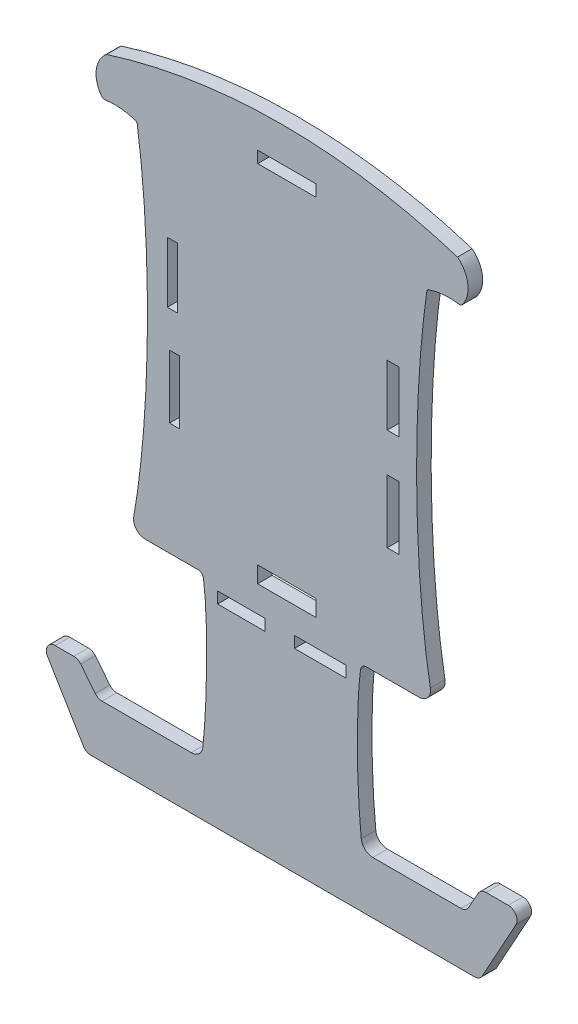
from build123d import *

# Parameters (mm, degrees)
SKETCH1_W           = 20
SKETCH1_H           = 4
SKETCH1_W_2         = 17.635389858
SKETCH1_H_2         = 3.879785769
SKETCH1_W_3         = 4.102446126
SKETCH1_H_3         = 20.774322756
SKETCH1_H_4         = 21.660832558
SKETCH1_W_4         = 3.418162198
SKETCH1_H_5         = 5.631856247
SKETCH1_W_5         = 16.224558669
BOSS_EXTRUDE3_DEPTH = 5


with BuildPart() as part:
    # Sketch1 → Boss-Extrude3 (new body)
    with BuildSketch(Plane.XY):
        with BuildLine():
            Line((-46.908869484, -52.720617246), (-28.908869484, -52.720617246))
            ThreePointArc((-28.908869484, -52.720617246), (-27.586230621, -53.216332062), (-26.915218553, -54.459251828))
            add(Edge.make_bspline(
                [(-27.150183285, -104.622936523), (-24.042180825, -75.385235173), (-26.915218553, -54.459251828)],
                knots=[4.03312472, 4.03312472, 4.03312472, 5.695988701, 5.695988701, 5.695988701], degree=2, weights=[1, 0.673818357, 1]))
            ThreePointArc((-27.150183285, -104.622936523), (-28.453010553, -107.174276905), (-31.127773146, -108.200113985))
            Line((-31.127773146, -108.200113985), (-61.691034949, -108.200113985))
            ThreePointArc((-61.691034949, -108.200113985), (-62.986836684, -107.905829762), (-64.028415748, -107.080712561))
            Line((-64.028415748, -107.080712561), (-69.031690033, -100.862183312))
            ThreePointArc((-69.031690033, -100.862183312), (-70.073269096, -100.037066111), (-71.369070832, -99.742781887))
            Line((-71.369070832, -99.742781887), (-77.798044438, -99.742781887))
            ThreePointArc((-77.798044438, -99.742781887), (-80.408451089, -101.264344498), (-80.370926301, -104.285597145))
            Line((-80.370926301, -104.285597145), (-68.103793269, -124.742929243))
            ThreePointArc((-68.103793269, -124.742929243), (-67.009348795, -125.810520637), (-65.530911406, -126.200113985))
            Line((-65.530911406, -126.200113985), (65.997283419, -126.200113985))
            ThreePointArc((65.997283419, -126.200113985), (67.523464533, -125.782897602), (68.625147136, -124.647294791))
            Line((68.625147136, -124.647294791), (80.198497538, -103.631822855))
            ThreePointArc((80.198497538, -103.631822855), (80.153417437, -100.658460936), (77.570633821, -99.18464205))
            Line((77.570633821, -99.18464205), (69.904360471, -99.18464205))
            ThreePointArc((69.904360471, -99.18464205), (68.383344987, -99.598812996), (67.282303117, -100.726967452))
            Line((67.282303117, -100.726967452), (63.985194726, -106.657788583))
            ThreePointArc((63.985194726, -106.657788583), (62.884152857, -107.785943039), (61.363137372, -108.200113985))
            Line((61.363137372, -108.200113985), (31.127773146, -108.200113985))
            ThreePointArc((31.127773146, -108.200113985), (28.453010553, -107.174276905), (27.150183285, -104.622936523))
            add(Edge.make_bspline(
                [(26.915218553, -54.459251828), (24.042180825, -75.385235173), (27.150183285, -104.622936523)],
                knots=[0.587196606, 0.587196606, 0.587196606, 2.250060588, 2.250060588, 2.250060588], degree=2, weights=[1, 0.673818357, 1]))
            ThreePointArc((26.915218553, -54.459251828), (27.586230621, -53.216332062), (28.908869484, -52.720617246))
            Line((28.908869484, -52.720617246), (46.908869484, -52.720617246))
            ThreePointArc((46.908869484, -52.720617246), (49.976562122, -51.287573006), (50.846185128, -48.015248183))
            add(Edge.make_bspline(
                [(49.632919584, 69.157622076), (40.820331779, 7.94829107), (50.846185128, -48.015248183)],
                knots=[0.92694213, 0.92694213, 0.92694213, 2.321414523, 2.321414523, 2.321414523], degree=2, weights=[1, 0.766619755, 1]))
            ThreePointArc((49.632919584, 69.157622076), (49.855189189, 69.656136563), (50.306120041, 69.963678167))
            ThreePointArc((50.306120041, 69.963678167), (55.512793259, 71.035230988), (60.82526432, 70.847287719))
            ThreePointArc((60.82526432, 70.847287719), (61.349200112, 70.906348269), (61.770271319, 71.223674443))
            ThreePointArc((61.770271319, 71.223674443), (63.704662293, 78.231916543), (60.165141812, 84.582437823))
            ThreePointArc((60.165141812, 84.582437823), (0, 93.879837075), (-60.165141812, 84.582437823))
            ThreePointArc((-60.165141812, 84.582437823), (-63.704662293, 78.231916543), (-61.770271319, 71.223674443))
            ThreePointArc((-61.770271319, 71.223674443), (-61.349200112, 70.906348269), (-60.82526432, 70.847287719))
            ThreePointArc((-60.82526432, 70.847287719), (-55.512793259, 71.035230988), (-50.306120041, 69.963678167))
            ThreePointArc((-50.306120041, 69.963678167), (-49.855189189, 69.656136563), (-49.632919584, 69.157622076))
            add(Edge.make_bspline(
                [(-50.846185128, -48.015248183), (-40.820331779, 7.94829107), (-49.632919584, 69.157622076)],
                knots=[3.961770785, 3.961770785, 3.961770785, 5.356243177, 5.356243177, 5.356243177], degree=2, weights=[1, 0.766619755, 1]))
            ThreePointArc((-50.846185128, -48.015248183), (-49.976562122, -51.287573006), (-46.908869484, -52.720617246))
        make_face()
        with Locations((1.663675391, 80.068012143)):
            Rectangle(SKETCH1_W, SKETCH1_H, mode=Mode.SUBTRACT)
        with Locations((13.088476945, -57.636754326)):
            Rectangle(SKETCH1_W_2, SKETCH1_H_2, mode=Mode.SUBTRACT)
        with Locations((38.10837085, 31.531905503)):
            Rectangle(SKETCH1_W_3, SKETCH1_H_3, mode=Mode.SUBTRACT)
        with Locations((38.10837085, -2.949787997)):
            Rectangle(SKETCH1_W_3, SKETCH1_H_4, mode=Mode.SUBTRACT)
        with Locations((-37.615690315, 30.327596937)):
            Rectangle(SKETCH1_W_4, SKETCH1_H_3, mode=Mode.SUBTRACT)
        with Locations((-36.862997462, -3.250865139)):
            Rectangle(SKETCH1_W_4, SKETCH1_H_4, mode=Mode.SUBTRACT)
        with Locations((1.610001599, -43.883655008)):
            Rectangle(SKETCH1_W, SKETCH1_H_5, mode=Mode.SUBTRACT)
        with Locations((-13.978236501, -57.624038848)):
            Rectangle(SKETCH1_W_5, SKETCH1_H_2, mode=Mode.SUBTRACT)
    extrude(amount=BOSS_EXTRUDE3_DEPTH)


solid = part.part
